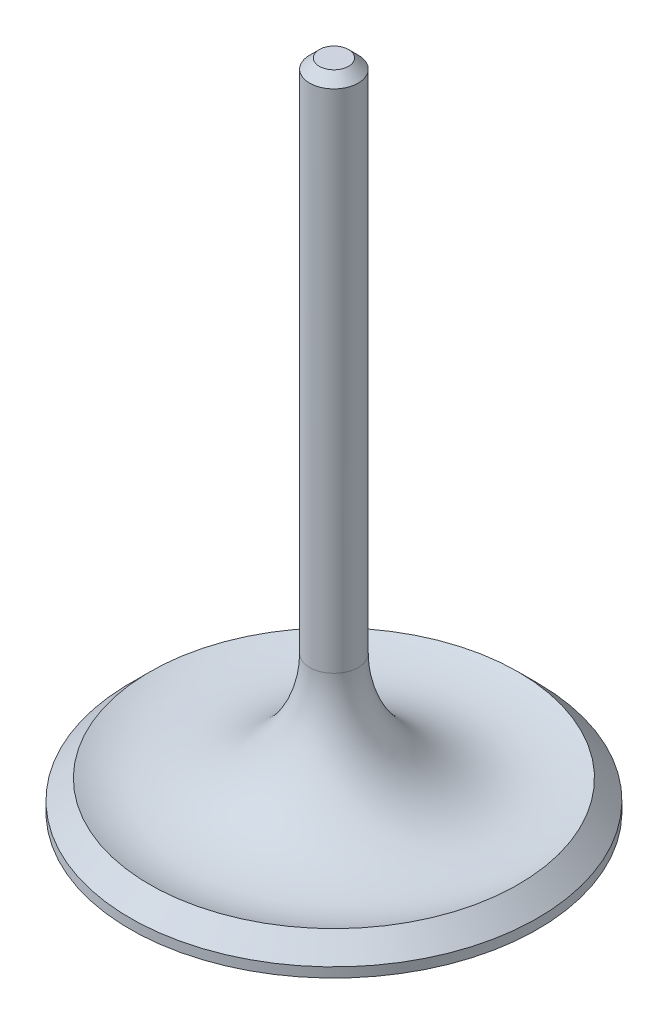
from build123d import *

# Parameters (mm, degrees)
CHAMFER1_SIZE = 1.27


with BuildPart() as part:
    # Sketch1 → Revolve2 (revolve)
    with BuildSketch(Plane.XY, mode=Mode.PRIVATE) as revolve2_sk:
        with BuildLine():
            Line((0, 0), (0, 85.5))
            Line((0, 85.5), (3.18, 85.5))
            Line((3.18, 85.5), (3.18, 17.954698654))
            ThreePointArc((3.18, 17.954698654), (9.896609701, 5.315721242), (24.13, 3.81))
            Line((24.13, 3.81), (26.67, 1.27))
            Line((26.67, 1.27), (26.67, 0))
            Line((26.67, 0), (0, 0))
        make_face()
    revolve(revolve2_sk.sketch.rotate(Axis((0, 0, 0), (0, 1, 0)), 90), axis=Axis((0, 0, 0), (0, 1, 0)))

    # Chamfer1
    chamfer1_edges = [part.edges().sort_by_distance(p)[0] for p in [
        (0, 85.5, 3.18),
    ]]
    chamfer(chamfer1_edges, length=CHAMFER1_SIZE)


solid = part.part
